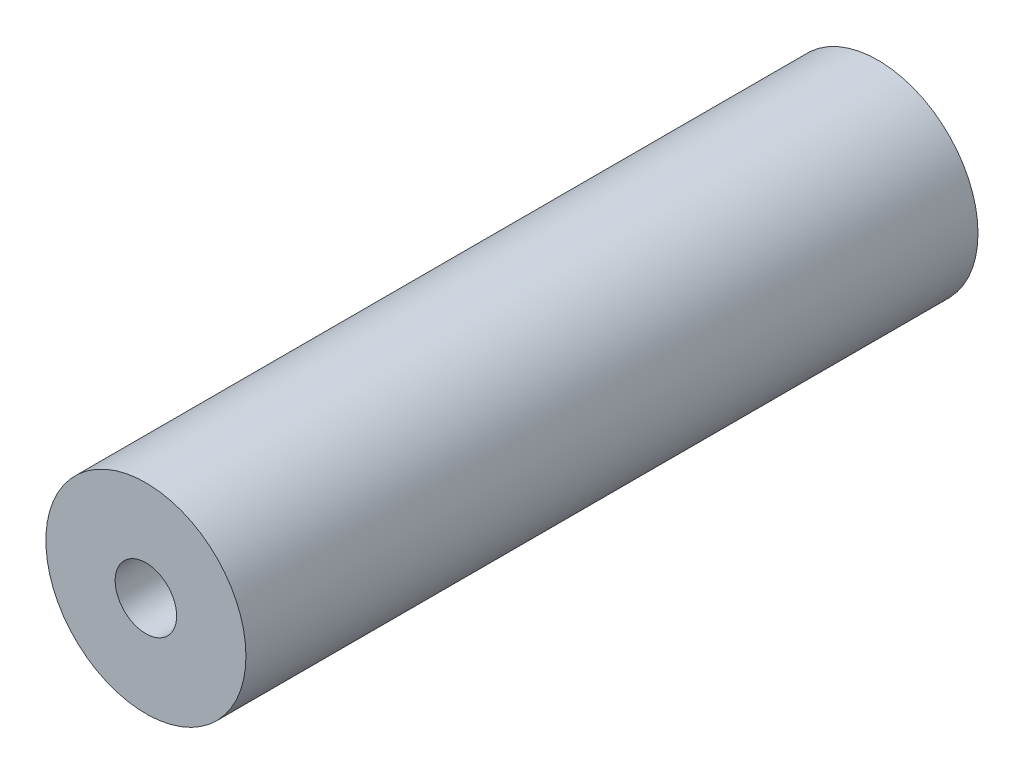
from build123d import *

# Parameters (mm, degrees)
CROQUIS1_R              = 2.05
CROQUIS1_R_2            = 0.63
SALIENTE_EXTRUIR1_DEPTH = 15


with BuildPart() as part:
    # Croquis1 → Saliente-Extruir1 (new body)
    with BuildSketch(Plane.XY):
        Circle(CROQUIS1_R)
        Circle(CROQUIS1_R_2, mode=Mode.SUBTRACT)
    extrude(amount=SALIENTE_EXTRUIR1_DEPTH)


solid = part.part
